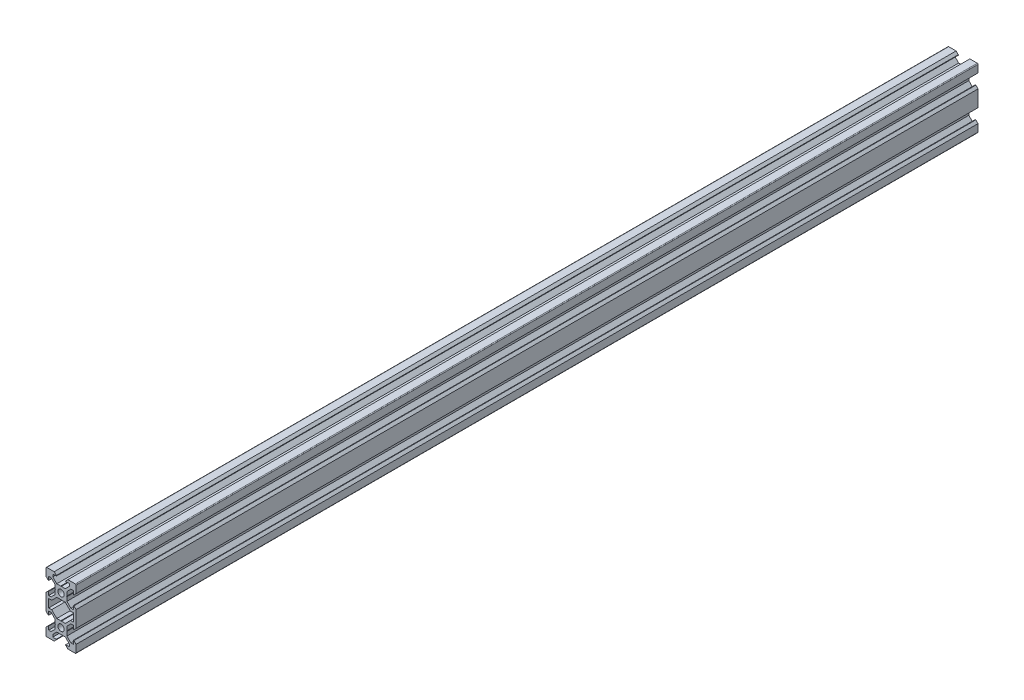
from build123d import *
from build123d.topology import SkipClean

# Parameters (mm, degrees)
BOSS_EXTRU_1_DEPTH     = 600
SYM_TRIE6_COPY_1_DEPTH = 600


with BuildPart() as part:
    # Esquisse1 → Boss.-Extru.1 (new body)
    with BuildSketch(Plane.XY):
        with BuildLine():
            Line((-9.5, 10), (-4.58, 10))
            Line((-4.58, 10), (-3.125, 8.545))
            Line((-3.125, 8.545), (-3.125, 8.2))
            Line((-3.125, 8.2), (-5.5, 8.2))
            Line((-5.5, 8.2), (-5.5, 6.560660172))
            Line((-5.5, 6.560660172), (-2.839339828, 3.9))
            Line((-2.839339828, 3.9), (-0.21, 3.9))
            Line((-0.21, 3.9), (0, 3.69))
            Line((0, 3.69), (0, 2.1))
            ThreePointArc((0, 2.1), (-2.1, 0), (0, -2.1))
            Line((0, -2.1), (0, -3.69))
            Line((0, -3.69), (-0.21, -3.9))
            Line((-0.21, -3.9), (-2.839339828, -3.9))
            Line((-2.839339828, -3.9), (-6.239339828, -7.3))
            Line((-6.239339828, -7.3), (-8.2, -7.3))
            Line((-8.2, -7.3), (-8.2, -10))
            Line((-8.2, -10), (-10, -10))
            Line((-10, -10), (-10, -4.58))
            Line((-10, -4.58), (-8.545, -3.125))
            Line((-8.545, -3.125), (-8.2, -3.125))
            Line((-8.2, -3.125), (-8.2, -5.5))
            Line((-8.2, -5.5), (-6.560660172, -5.5))
            Line((-6.560660172, -5.5), (-3.9, -2.839339828))
            Line((-3.9, -2.839339828), (-3.9, -0.21))
            Line((-3.9, -0.21), (-3.69, 0))
            Line((-3.69, 0), (-3.9, 0.21))
            Line((-3.9, 0.21), (-3.9, 2.839339828))
            Line((-3.9, 2.839339828), (-6.560660172, 5.5))
            Line((-6.560660172, 5.5), (-8.2, 5.5))
            Line((-8.2, 5.5), (-8.2, 3.125))
            Line((-8.2, 3.125), (-8.545, 3.125))
            Line((-8.545, 3.125), (-10, 4.58))
            Line((-10, 4.58), (-10, 9.5))
            ThreePointArc((-10, 9.5), (-9.853553391, 9.853553391), (-9.5, 10))
        make_face()
    boss_extru_1 = extrude(amount=BOSS_EXTRU_1_DEPTH)

    # Symétrie1: Boss.-Extru.1 across plane
    add(boss_extru_1.mirror(Plane(origin=(0, 3.69, 600), x_dir=(0, 0, 1), z_dir=(-1, 0, 0))))

    # Symétrie6: Boss.-Extru.1 across plane
    add(boss_extru_1.mirror(Plane(origin=(-8.2, -10, 600), x_dir=(0, 0, 1), z_dir=(0, 1, 0))))

    # Symétrie6 copy 1 sketch → Symétrie6 copy 1 (add)
    with SkipClean():  # the faces are left unmerged after this step: merging them gives an invalid solid
        with BuildSketch(Plane(origin=(0, -20, 0), x_dir=(-1, 0, 0), z_dir=(0, 0, 1))):
            with BuildLine():
                Line((-9.5, 10), (-4.58, 10))
                Line((-4.58, 10), (-3.125, 8.545))
                Line((-3.125, 8.545), (-3.125, 8.2))
                Line((-3.125, 8.2), (-5.5, 8.2))
                Line((-5.5, 8.2), (-5.5, 6.560660172))
                Line((-5.5, 6.560660172), (-2.839339828, 3.9))
                Line((-2.839339828, 3.9), (-0.21, 3.9))
                Line((-0.21, 3.9), (0, 3.69))
                Line((0, 3.69), (0, 2.1))
                ThreePointArc((0, 2.1), (-2.1, 0), (0, -2.1))
                Line((0, -2.1), (0, -3.69))
                Line((0, -3.69), (-0.21, -3.9))
                Line((-0.21, -3.9), (-2.839339828, -3.9))
                Line((-2.839339828, -3.9), (-6.239339828, -7.3))
                Line((-6.239339828, -7.3), (-8.2, -7.3))
                Line((-8.2, -7.3), (-8.2, -10))
                Line((-8.2, -10), (-10, -10))
                Line((-10, -10), (-10, -4.58))
                Line((-10, -4.58), (-8.545, -3.125))
                Line((-8.545, -3.125), (-8.2, -3.125))
                Line((-8.2, -3.125), (-8.2, -5.5))
                Line((-8.2, -5.5), (-6.560660172, -5.5))
                Line((-6.560660172, -5.5), (-3.9, -2.839339828))
                Line((-3.9, -2.839339828), (-3.9, -0.21))
                Line((-3.9, -0.21), (-3.69, 0))
                Line((-3.69, 0), (-3.9, 0.21))
                Line((-3.9, 0.21), (-3.9, 2.839339828))
                Line((-3.9, 2.839339828), (-6.560660172, 5.5))
                Line((-6.560660172, 5.5), (-8.2, 5.5))
                Line((-8.2, 5.5), (-8.2, 3.125))
                Line((-8.2, 3.125), (-8.545, 3.125))
                Line((-8.545, 3.125), (-10, 4.58))
                Line((-10, 4.58), (-10, 9.5))
                ThreePointArc((-10, 9.5), (-9.853553391, 9.853553391), (-9.5, 10))
            make_face()
        extrude(amount=SYM_TRIE6_COPY_1_DEPTH)


solid = part.part
